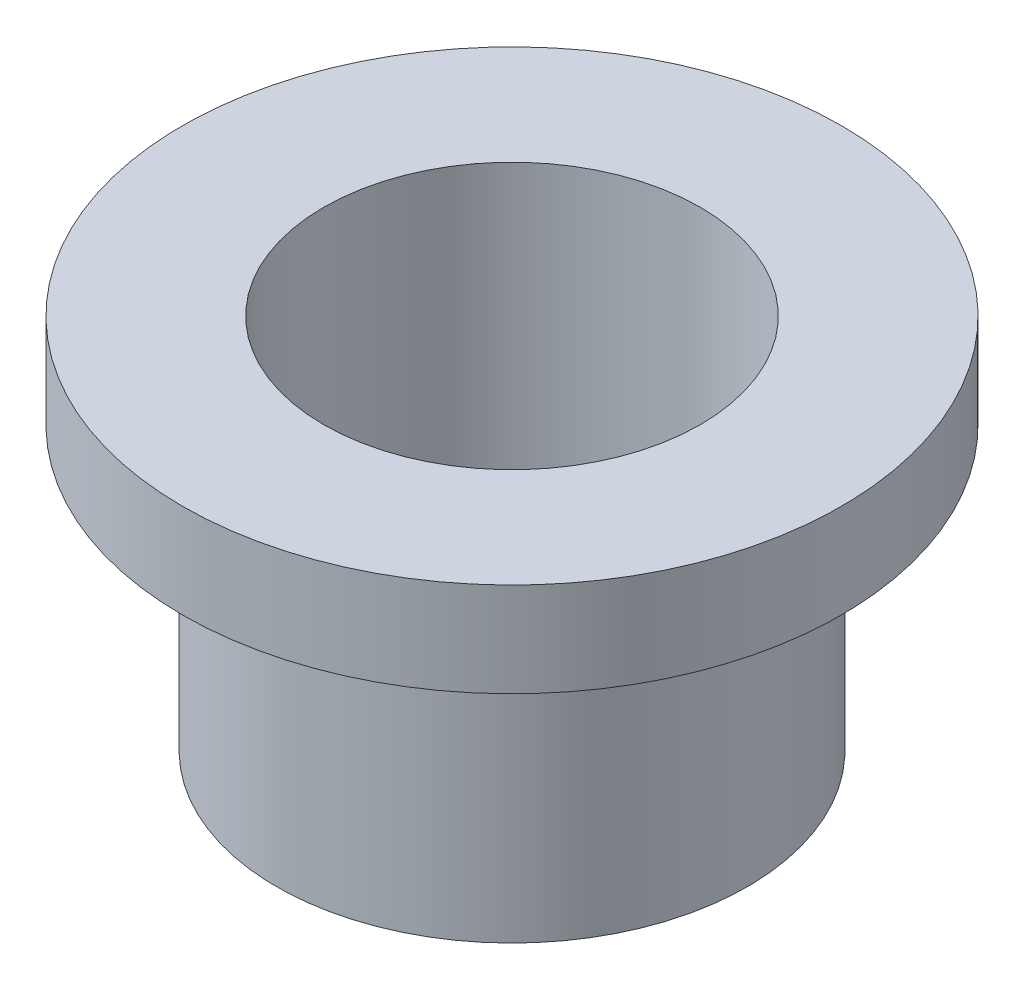
from build123d import *

# Parameters (mm, degrees)
SKETCH1_R           = 7.9375
SKETCH1_R_2         = 6.35
BOSS_EXTRUDE1_DEPTH = 9.525
SKETCH2_R           = 11.1125
SKETCH2_R_2         = 6.35
BOSS_EXTRUDE2_DEPTH = 3.175


with BuildPart() as part:
    # Sketch1 → Boss-Extrude1 (new body)
    with BuildSketch(Plane(origin=(0, 0, 0), x_dir=(1, 0, 0), z_dir=(0, 1, 0))):
        with Locations(Location((0, 0, 0), (0, 0, 90))):
            Circle(SKETCH1_R)
        with Locations(Location((0, 0, 0), (0, 0, 90))):
            Circle(SKETCH1_R_2, mode=Mode.SUBTRACT)
    extrude(amount=BOSS_EXTRUDE1_DEPTH)

    # Sketch2 → Boss-Extrude2 (add)
    with BuildSketch(Plane(origin=(0, 9.525, 0), x_dir=(1, 0, 0), z_dir=(0, 1, 0))):
        with Locations(Location((0, 0, 0), (0, 0, 270))):
            Circle(SKETCH2_R)
        with Locations(Location((0, 0, 0), (0, 0, 90))):
            Circle(SKETCH2_R_2, mode=Mode.SUBTRACT)
    extrude(amount=BOSS_EXTRUDE2_DEPTH)


solid = part.part
